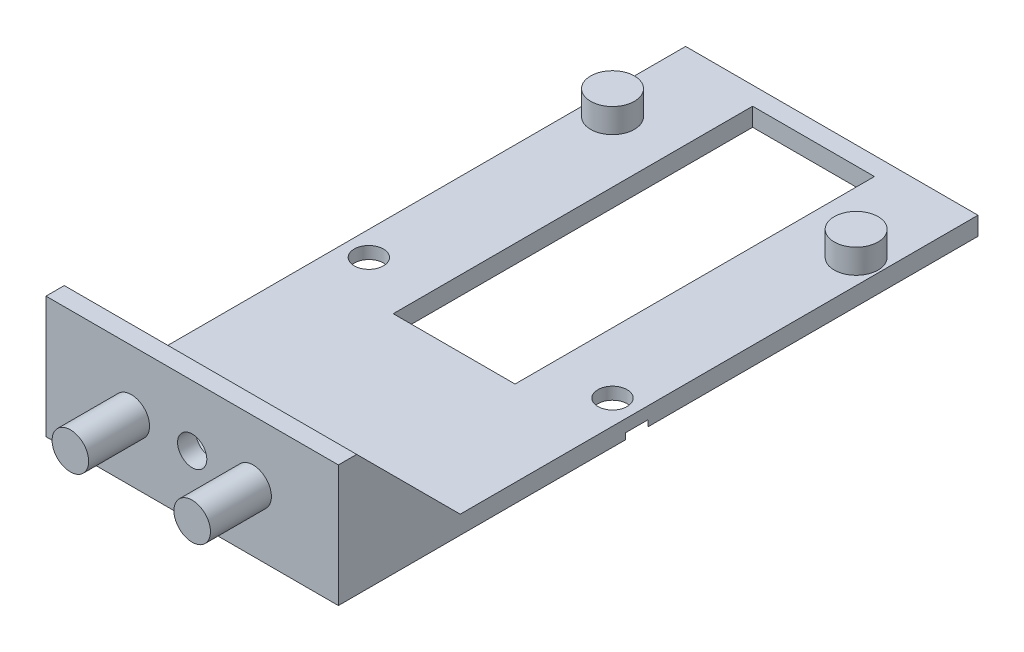
from build123d import *

# Parameters (mm, degrees)
ESQUISSE1_W             = 24
ESQUISSE1_H             = 38
ESQUISSE1_W_2           = 10
ESQUISSE1_H_2           = 29.5
SHAPE_DEPTH             = 1.5
ESQUISSE2_R             = 1.2
VISHOLES_DEPTH          = 1.5
ESQUISSE3_R             = 1.8
LOCKERS_DEPTH           = 2
ESQUISSE4_R             = 2.2
SCREWHATREMOVER_DEPTH   = 0.5
ESQUISSE6_W             = 24
ESQUISSE6_H             = 14.5
RALLONGE_DEPTH          = 1.5
ESQUISSE7_W             = 24
ESQUISSE7_H             = 1.5
BOSS_EXTRU_2_DEPTH      = 8.5
ESQUISSE8_R             = 1.2
ENL_V_MAT_EXTRU_1_DEPTH = 10
ESQUISSE9_R             = 1.5
BOSS_EXTRU_3_DEPTH      = 5
NERVURE11_REACH         = 48.457
ESQUISSE12_WALL_W       = 106.934753954
ESQUISSE12_WALL_H       = 1


with BuildPart() as part:
    # Esquisse1 → Shape (new body)
    with BuildSketch(Plane(origin=(0, 0, 0), x_dir=(1, 0, 0), z_dir=(0, 1, 0))):
        Rectangle(ESQUISSE1_W, ESQUISSE1_H)
        with Locations((0, 2.75)):
            Rectangle(ESQUISSE1_W_2, ESQUISSE1_H_2, mode=Mode.SUBTRACT)
    extrude(amount=SHAPE_DEPTH)

    # Esquisse2 → VisHoles (cut)
    with BuildSketch(Plane(origin=(0, 1.5, 0), x_dir=(1, 0, 0), z_dir=(0, 1, 0))):
        with Locations(Location((10, -9, 0), (0, 0, 270))):
            Circle(ESQUISSE2_R)
    visholes = extrude(amount=-VISHOLES_DEPTH, mode=Mode.SUBTRACT)

    # Esquisse3 → Lockers (add)
    with BuildSketch(Plane(origin=(0, 1.5, 0), x_dir=(1, 0, 0), z_dir=(0, 1, 0))):
        with Locations(Location((10, 11, 0), (0, 0, 90))):
            Circle(ESQUISSE3_R)
    lockers = extrude(amount=LOCKERS_DEPTH)

    # Esquisse4 → ScrewHatRemover (cut)
    with BuildSketch(Plane(origin=(0, 0, 0), x_dir=(1, 0, 0), z_dir=(0, 1, 0))):
        with Locations((10, -9)):
            Circle(ESQUISSE4_R)
    screwhatremover = extrude(amount=SCREWHATREMOVER_DEPTH, mode=Mode.SUBTRACT)

    # Symétrie1: VisHoles, Lockers, ScrewHatRemover across plane
    add(visholes.mirror(Plane(origin=(0, 0, 0), x_dir=(0, 0, 1), z_dir=(1, 0, 0))), mode=Mode.SUBTRACT)
    add(lockers.mirror(Plane(origin=(0, 0, 0), x_dir=(0, 0, 1), z_dir=(1, 0, 0))))
    add(screwhatremover.mirror(Plane(origin=(0, 0, 0), x_dir=(0, 0, 1), z_dir=(1, 0, 0))), mode=Mode.SUBTRACT)

    # Esquisse6 → Rallonge (add)
    with BuildSketch(Plane.XZ):
        with Locations((0, 26.25)):
            Rectangle(ESQUISSE6_W, ESQUISSE6_H)
    extrude(amount=-RALLONGE_DEPTH)

    # Esquisse7 → Boss.-Extru.2 (add)
    with BuildSketch(Plane(origin=(0, 1.5, 0), x_dir=(1, 0, 0), z_dir=(0, 1, 0))):
        with Locations((0, -32.75)):
            Rectangle(ESQUISSE7_W, ESQUISSE7_H)
    extrude(amount=BOSS_EXTRU_2_DEPTH)

    # Esquisse8 → Enlèv. mat.-Extru.1 (cut)
    with BuildSketch(Plane.XY.offset(33.5)):
        with Locations((0, 5)):
            Circle(ESQUISSE8_R)
    extrude(amount=-ENL_V_MAT_EXTRU_1_DEPTH, mode=Mode.SUBTRACT)

    # Esquisse9 → Boss.-Extru.3 (add)
    with BuildSketch(Plane.XY.offset(33.5)):
        with Locations((5, 5)):
            Circle(ESQUISSE9_R)
        with Locations((-5, 5)):
            Circle(ESQUISSE9_R)
    extrude(amount=BOSS_EXTRU_3_DEPTH)

    # Esquisse12 wall → Nervure11 (add, up to next)
    with BuildSketch(Plane(origin=(-12, 5.75, 27.75), x_dir=(0, -0.707106781187, -0.707106781187), z_dir=(0, -0.707106781187, 0.707106781187)), mode=Mode.PRIVATE) as nervure11_sk1:
        with Locations((0, 0.5)):
            Rectangle(ESQUISSE12_WALL_W, ESQUISSE12_WALL_H)
    nervure11_tool1 = extrude(nervure11_sk1.sketch, amount=NERVURE11_REACH, mode=Mode.PRIVATE) - part.part
    nervure11 = nervure11_tool1.solids().sort_by_distance((-12, 5.75, 27.75))[0]
    add(nervure11)

    # Symétrie2: Nervure11 across plane
    add(nervure11.mirror(Plane(origin=(0, 0, 0), x_dir=(0, 0, 1), z_dir=(1, 0, 0))))


solid = part.part
